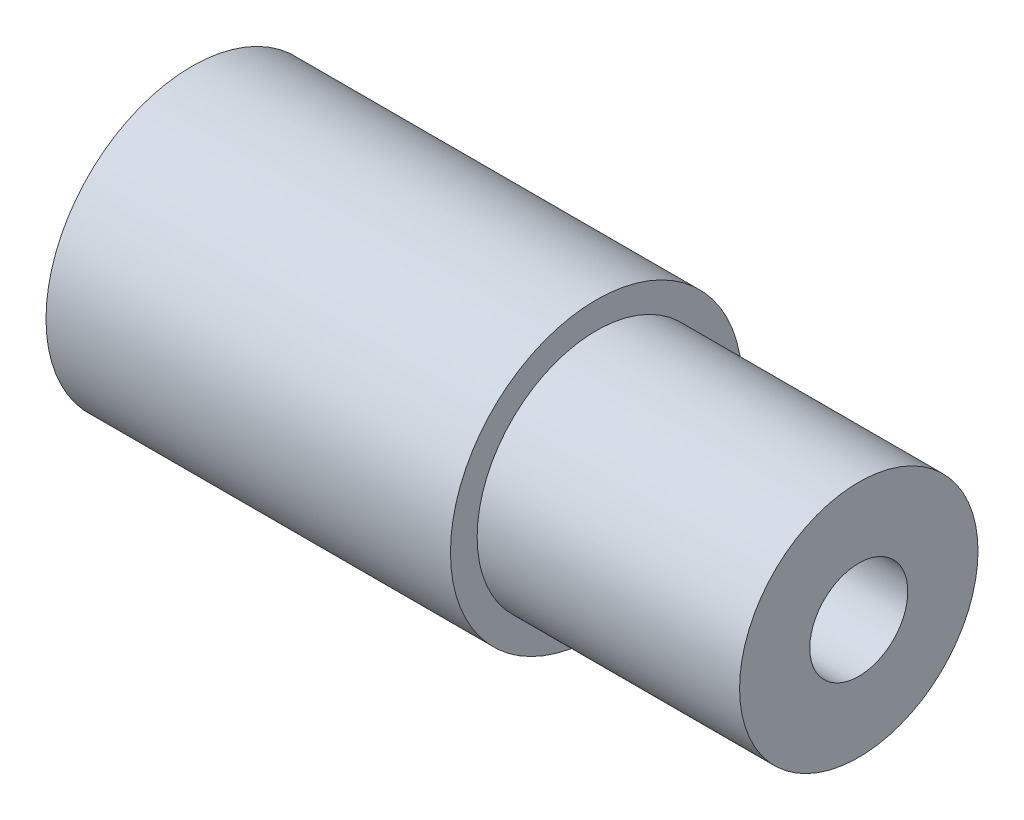
from build123d import *

# Parameters (mm, degrees)
SOCKET_1_SKETCH_W = 17.8
SOCKET_1_SKETCH_H = 4.7625
SOCKET_2_SKETCH_W = 16.2
SOCKET_2_SKETCH_H = 3.175


with BuildPart() as part:
    # Reducer_T6_T4 Sketch → Reducer_T6_T4 (revolve)
    with BuildSketch(Plane.XY):
        Polygon((-21.6, 0), (-21.6, 9.45), (0.4, 9.45), (4.6, 9.45), (4.6, 7.722), (21.6, 7.722), (21.6, 0), align=None)
    revolve(axis=Axis((-1000, 0, 0), (1, 0, 0)))

    # Socket 1 Sketch → Socket 1 (revolve, cut)
    with BuildSketch(Plane.XY):
        with Locations((-13.7, 2.38125)):
            Rectangle(SOCKET_1_SKETCH_W, SOCKET_1_SKETCH_H)
    revolve(axis=Axis((-1000, 0, 0), (1, 0, 0)), mode=Mode.SUBTRACT)

    # Socket 2 Sketch → Socket 2 (revolve, cut)
    with BuildSketch(Plane.XY):
        with Locations((14.5, 1.5875)):
            Rectangle(SOCKET_2_SKETCH_W, SOCKET_2_SKETCH_H)
    revolve(axis=Axis((-1000, 0, 0), (1, 0, 0)), mode=Mode.SUBTRACT)


solid = part.part
